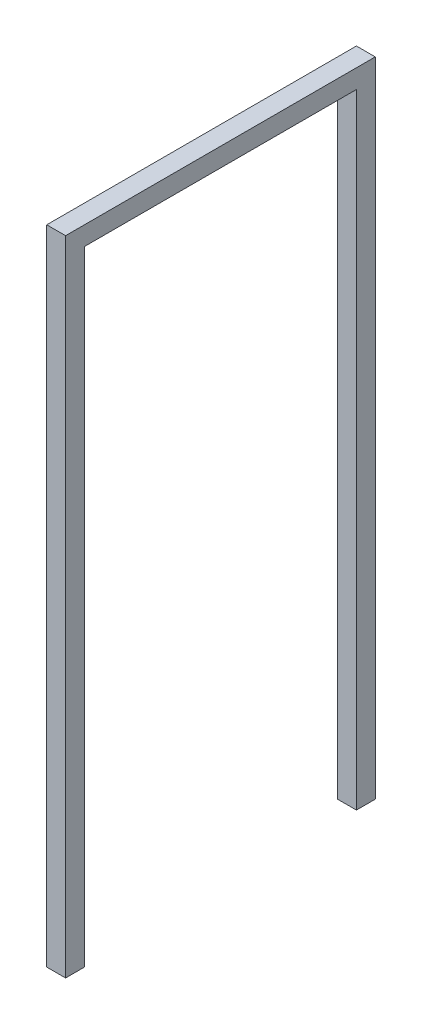
from build123d import *

# Parameters (mm, degrees)
CROQUIS1_W                 = 76.2
CROQUIS1_H                 = 76.2
SALIENTE_EXTRUIR1_DEPTH    = 2600
SALIENTE_EXTRUIR1_2_DEPTH  = 2600
SALIENTE_EXTRUIR1_3_DEPTH  = 2600
SALIENTE_EXTRUIR1_4_DEPTH  = 2600
SALIENTE_EXTRUIR1_5_DEPTH  = 2600
SALIENTE_EXTRUIR1_6_DEPTH  = 2600
SALIENTE_EXTRUIR1_7_DEPTH  = 2600
SALIENTE_EXTRUIR1_8_DEPTH  = 2600
SALIENTE_EXTRUIR1_9_DEPTH  = 2600
SALIENTE_EXTRUIR1_10_DEPTH = 2600
CROQUIS2_W                 = 76.2
CROQUIS2_H                 = 76.2
SALIENTE_EXTRUIR2_DEPTH    = 1100
CROQUIS3_W                 = 1252.4
CROQUIS3_H                 = 2600
CORTAR_EXTRUIR1_DEPTH      = 5924.8


with BuildPart() as part:
    # Croquis1 → Saliente-Extruir1 (new body)
    with BuildSketch(Plane(origin=(0, 0, 0), x_dir=(1, 0, 0), z_dir=(0, 1, 0))):
        with Locations((38.1, -38.1)):
            Rectangle(CROQUIS1_W, CROQUIS1_H)
    extrude(amount=SALIENTE_EXTRUIR1_DEPTH)



with BuildPart() as body_2:
    # Croquis1 → Saliente-Extruir1 2 (new body)
    with BuildSketch(Plane(origin=(0, 0, 0), x_dir=(1, 0, 0), z_dir=(0, 1, 0))):
        with Locations((1519.3, -38.1)):
            Rectangle(CROQUIS1_W, CROQUIS1_H)
    extrude(amount=SALIENTE_EXTRUIR1_2_DEPTH)


with BuildPart() as body_3:
    # Croquis1 → Saliente-Extruir1 3 (new body)
    with BuildSketch(Plane(origin=(0, 0, 0), x_dir=(1, 0, 0), z_dir=(0, 1, 0))):
        with Locations((3000.5, -38.1)):
            Rectangle(CROQUIS1_W, CROQUIS1_H)
    extrude(amount=SALIENTE_EXTRUIR1_3_DEPTH)


with BuildPart() as body_4:
    # Croquis1 → Saliente-Extruir1 4 (new body)
    with BuildSketch(Plane(origin=(0, 0, 0), x_dir=(1, 0, 0), z_dir=(0, 1, 0))):
        with Locations((4481.7, -38.1)):
            Rectangle(CROQUIS1_W, CROQUIS1_H)
    extrude(amount=SALIENTE_EXTRUIR1_4_DEPTH)


with BuildPart() as body_5:
    # Croquis1 → Saliente-Extruir1 5 (new body)
    with BuildSketch(Plane(origin=(0, 0, 0), x_dir=(1, 0, 0), z_dir=(0, 1, 0))):
        with Locations((5962.9, -38.1)):
            Rectangle(CROQUIS1_W, CROQUIS1_H)
    extrude(amount=SALIENTE_EXTRUIR1_5_DEPTH)


with BuildPart() as body_6:
    # Croquis1 → Saliente-Extruir1 6 (new body)
    with BuildSketch(Plane(origin=(0, 0, 0), x_dir=(1, 0, 0), z_dir=(0, 1, 0))):
        with Locations((5962.9, -1214.3)):
            Rectangle(CROQUIS1_W, CROQUIS1_H)
    extrude(amount=SALIENTE_EXTRUIR1_6_DEPTH)


with BuildPart() as body_7:
    # Croquis1 → Saliente-Extruir1 7 (new body)
    with BuildSketch(Plane(origin=(0, 0, 0), x_dir=(1, 0, 0), z_dir=(0, 1, 0))):
        with Locations((4481.7, -1214.3)):
            Rectangle(CROQUIS1_W, CROQUIS1_H)
    extrude(amount=SALIENTE_EXTRUIR1_7_DEPTH)


with BuildPart() as body_8:
    # Croquis1 → Saliente-Extruir1 8 (new body)
    with BuildSketch(Plane(origin=(0, 0, 0), x_dir=(1, 0, 0), z_dir=(0, 1, 0))):
        with Locations((3000.5, -1214.3)):
            Rectangle(CROQUIS1_W, CROQUIS1_H)
    extrude(amount=SALIENTE_EXTRUIR1_8_DEPTH)


with BuildPart() as body_9:
    # Croquis1 → Saliente-Extruir1 9 (new body)
    with BuildSketch(Plane(origin=(0, 0, 0), x_dir=(1, 0, 0), z_dir=(0, 1, 0))):
        with Locations((1519.3, -1214.3)):
            Rectangle(CROQUIS1_W, CROQUIS1_H)
    extrude(amount=SALIENTE_EXTRUIR1_9_DEPTH)


with BuildPart() as body_10:
    # Croquis1 → Saliente-Extruir1 10 (new body)
    with BuildSketch(Plane(origin=(0, 0, 0), x_dir=(1, 0, 0), z_dir=(0, 1, 0))):
        with Locations((38.1, -1214.3)):
            Rectangle(CROQUIS1_W, CROQUIS1_H)
    extrude(amount=SALIENTE_EXTRUIR1_10_DEPTH)


with BuildPart() as part_1:
    add(part.part)

    add(body_2.part)  # Saliente-Extruir2 merges body 2

    add(body_3.part)  # Saliente-Extruir2 merges body 3

    add(body_4.part)  # Saliente-Extruir2 merges body 4

    add(body_5.part)  # Saliente-Extruir2 merges body 5

    add(body_6.part)  # Saliente-Extruir2 merges body 6

    add(body_7.part)  # Saliente-Extruir2 merges body 7

    add(body_8.part)  # Saliente-Extruir2 merges body 8

    add(body_9.part)  # Saliente-Extruir2 merges body 9

    add(body_10.part)  # Saliente-Extruir2 merges body 10
    # Croquis2 → Saliente-Extruir2 (add)
    with BuildSketch(Plane.XY.offset(76.2)):
        with Locations((38.1, 2561.9)):
            Rectangle(CROQUIS2_W, CROQUIS2_H)
        with Locations((1519.3, 2561.9)):
            Rectangle(CROQUIS2_W, CROQUIS2_H)
        with Locations((3000.5, 2561.9)):
            Rectangle(CROQUIS2_W, CROQUIS2_H)
        with Locations((4481.7, 2561.9)):
            Rectangle(CROQUIS2_W, CROQUIS2_H)
        with Locations((5962.9, 2561.9)):
            Rectangle(CROQUIS2_W, CROQUIS2_H)
    extrude(amount=SALIENTE_EXTRUIR2_DEPTH)

    # Croquis3 → Cortar-Extruir1 (cut)
    with BuildSketch(Plane(origin=(6001, 0, 0), x_dir=(0, 0, -1), z_dir=(1, 0, 0))):
        with Locations((-626.2, 1300)):
            Rectangle(CROQUIS3_W, CROQUIS3_H)
    extrude(amount=-CORTAR_EXTRUIR1_DEPTH, mode=Mode.SUBTRACT)


solid = part_1.part
